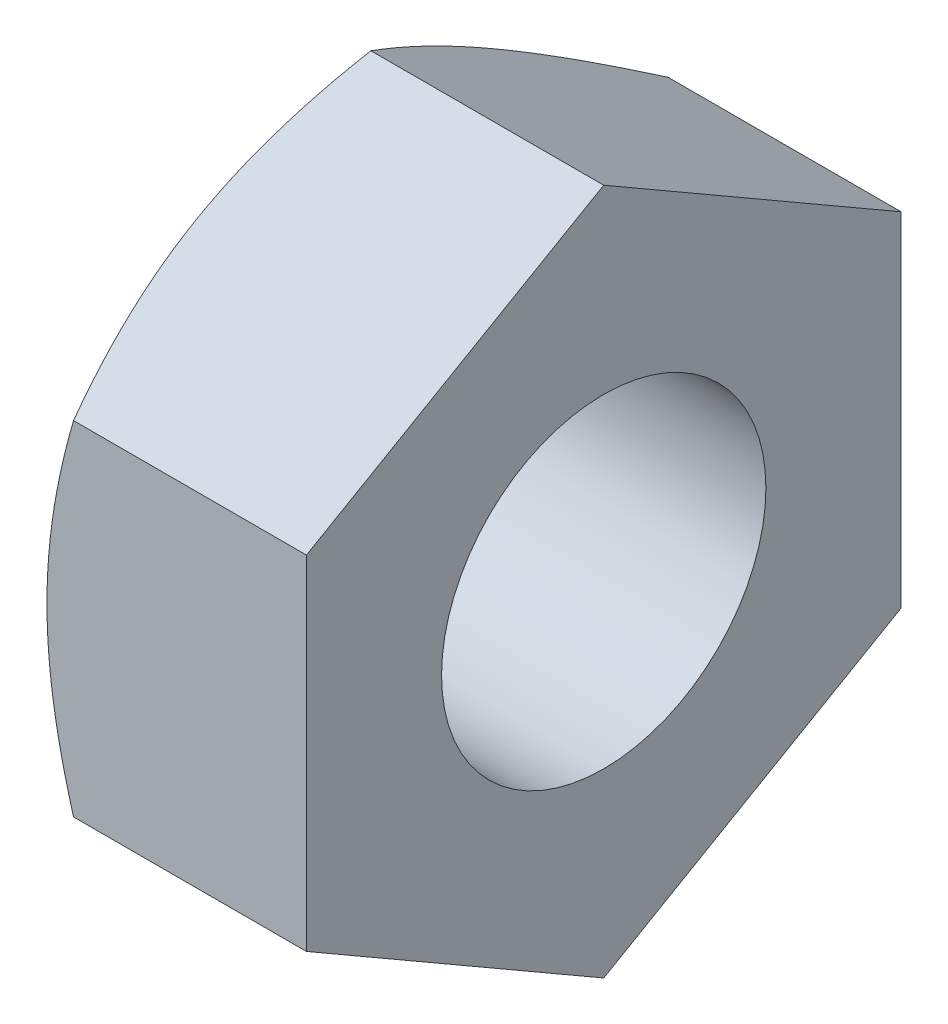
from build123d import *

# Parameters (mm, degrees)
BOSS_EXTRUDE1_DEPTH = 2.4
SKETCH8_R           = 1.5
CUT_EXTRUDE1_DEPTH  = 5.837957558


with BuildPart() as part:
    # Sketch1 → Boss-Extrude1 (new body)
    with BuildSketch(Plane(origin=(0, 0, 0), x_dir=(0, 0, -1), z_dir=(1, 0, 0))):
        Polygon((0, 3.175426481), (-2.75, 1.58771324), (-2.75, -1.58771324), (0, -3.175426481), (2.75, -1.58771324), (2.75, 1.58771324), align=None)
    extrude(amount=-BOSS_EXTRUDE1_DEPTH)

    # Sketch2 → Cut-Revolve1 (revolve, cut)
    with BuildSketch(Plane.XY):
        Polygon((-2.4, 2.75), (-2.154379907, 3.175426481), (-2.4, 3.175426481), align=None)
    revolve(axis=Axis((-2.23854625, 0, 0), (1, 0, 0)), mode=Mode.SUBTRACT)

    # Sketch8 → Cut-Extrude1 (cut, through all)
    with BuildSketch(Plane(origin=(0, 0, 0), x_dir=(0, 0, -1), z_dir=(1, 0, 0))):
        Circle(SKETCH8_R)
    extrude(amount=-CUT_EXTRUDE1_DEPTH, mode=Mode.SUBTRACT)


solid = part.part
